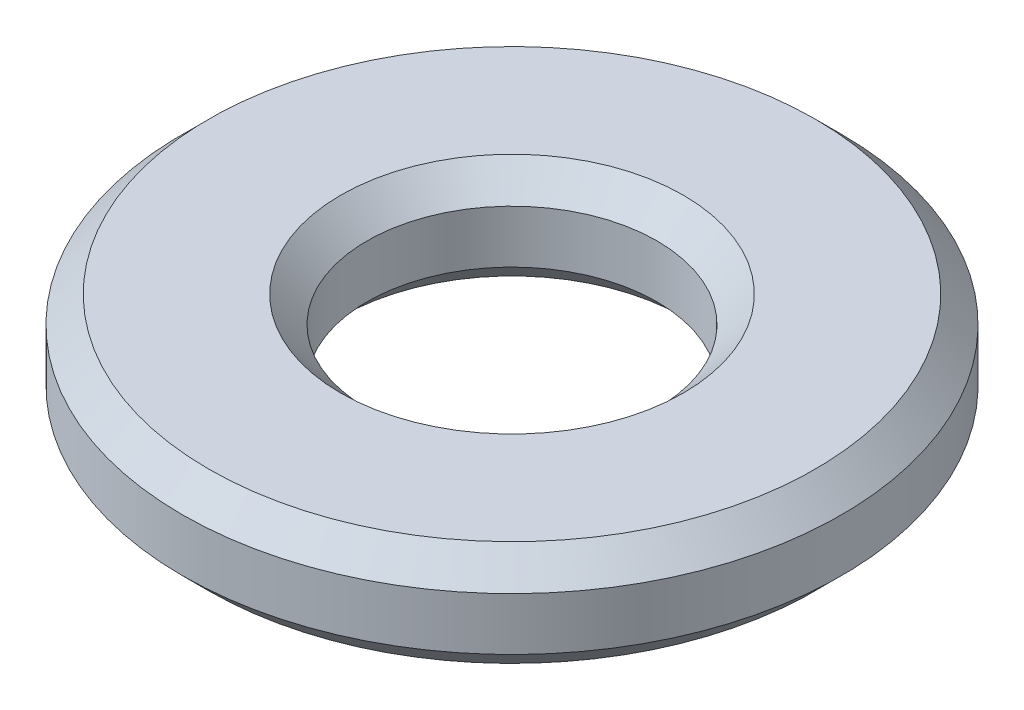
from build123d import *

# Parameters (mm, degrees)
CROQUIS1_R              = 2.5
CROQUIS1_R_2            = 1.1
SALIENTE_EXTRUIR1_DEPTH = 0.8
CHAFL_N1_SIZE           = 0.2


with BuildPart() as part:
    # Croquis1 → Saliente-Extruir1 (new body)
    with BuildSketch(Plane(origin=(0, 0, 0), x_dir=(1, 0, 0), z_dir=(0, 1, 0))):
        with Locations(Location((0, 0, 0), (0, 0, 270))):
            Circle(CROQUIS1_R)
        with Locations(Location((0, 0, 0), (0, 0, 270))):
            Circle(CROQUIS1_R_2, mode=Mode.SUBTRACT)
    extrude(amount=SALIENTE_EXTRUIR1_DEPTH)

    # Chaflán1
    chafl_n1_edges = [part.edges().sort_by_distance(p)[0] for p in [
        (0, 0, -2.5),
        (0, 0.8, -2.5),
        (0, 0, -1.1),
        (0, 0.8, -1.1),
    ]]
    chamfer(chafl_n1_edges, length=CHAFL_N1_SIZE)


solid = part.part
